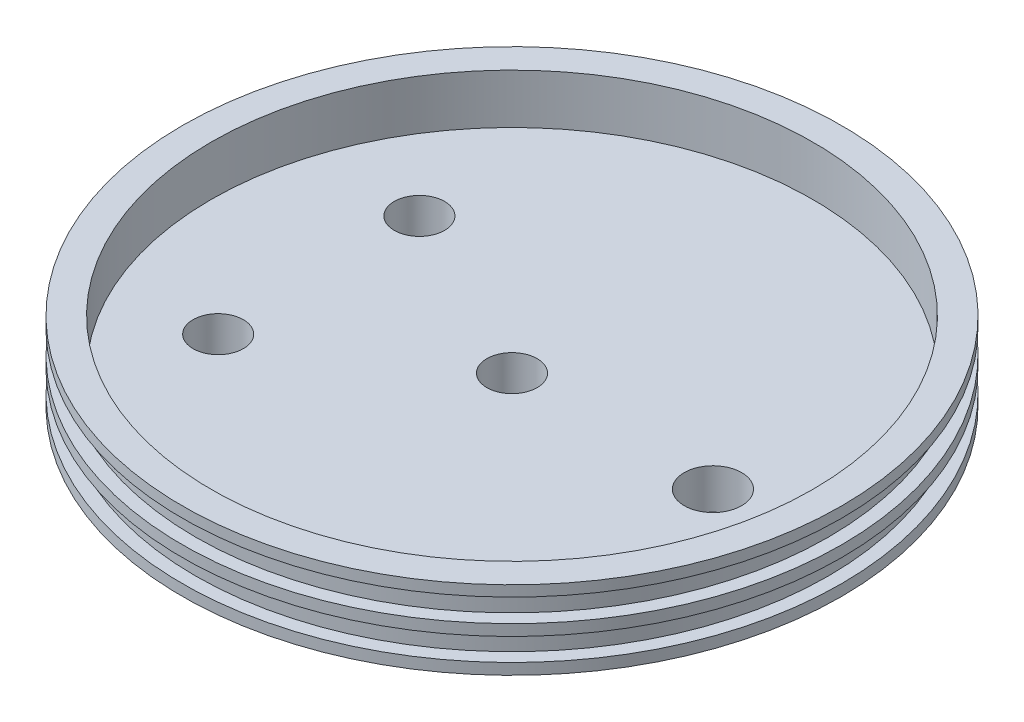
from build123d import *

# Parameters (mm, degrees)
SKETCH6_R                                = 66.04
BOSS_EXTRUDE1_DEPTH                      = 2.54
PIPE_TAP_DRILL_FOR_1_4_TAP_GN2_D         = 11.1252
SKETCH7_R                                = 6.35
CUT_EXTRUDE1_SIPHON_DEPTH                = 105.994177492
PIPE_TAP_DRILL_FOR_1_4_TAP_RELIEF_VALV_D = 11.1252
PIPE_TAP_DRILL_FOR_1_4_TAP_VENT_VALVE_D  = 11.1252


with BuildPart() as part:
    # Sketch1 → Revolve1 (revolve)
    with BuildSketch(Plane.XY, mode=Mode.PRIVATE) as revolve1_sk:
        Polygon((0, 0), (72.898, 0), (72.898, 2.4638), (69.977, 2.4638), (69.977, 7.4422), (72.898, 7.4422), (72.898, 9.906), (69.977, 9.906), (69.977, 14.986), (72.898, 14.986), (72.898, 17.3482), (66.548, 17.3482), (66.548, 6.35), (0, 6.35), align=None)
    revolve(revolve1_sk.sketch.rotate(Axis((0, 48.192213231, 0), (0, -1, 0)), 180), axis=Axis((0, 48.192213231, 0), (0, -1, 0)))

    # Sketch6 → Boss-Extrude1 (add)
    with BuildSketch(Plane.XZ):
        Circle(SKETCH6_R)
    extrude(amount=BOSS_EXTRUDE1_DEPTH)

    # Pipe Tap Drill for 1/4 Tap - GN2 (through all)
    with Locations(Plane(origin=(0, 6.35, 0), x_dir=(1, 0, 0), z_dir=(0, 1, 0))):
        with Locations((0, 0)):
            Hole(PIPE_TAP_DRILL_FOR_1_4_TAP_GN2_D / 2)

    # Sketch7 → Cut-Extrude1-Siphon (cut, through all)
    with BuildSketch(Plane(origin=(0, -2.54, 0), x_dir=(-1, 0, 0), z_dir=(0, -1, 0))):
        with Locations(Location((-44.45, 0, 0), (0, 0, 180))):
            Circle(SKETCH7_R)
    extrude(amount=-CUT_EXTRUDE1_SIPHON_DEPTH, mode=Mode.SUBTRACT)

    # Pipe Tap Drill for 1/4 Tap - Relief Valve (through all)
    with Locations(Plane(origin=(0, -2.54, 0), x_dir=(-1, 0, 0), z_dir=(0, -1, 0))):
        with Locations((40.358041229, 19.878625199)):
            Hole(PIPE_TAP_DRILL_FOR_1_4_TAP_RELIEF_VALV_D / 2)

    # Pipe Tap Drill for 1/4 Tap - Vent Valve (through all)
    with Locations(Plane(origin=(0, -2.54, 0), x_dir=(-1, 0, 0), z_dir=(0, -1, 0))):
        with Locations((39.961427255, -25.031151171)):
            Hole(PIPE_TAP_DRILL_FOR_1_4_TAP_VENT_VALVE_D / 2)


solid = part.part
